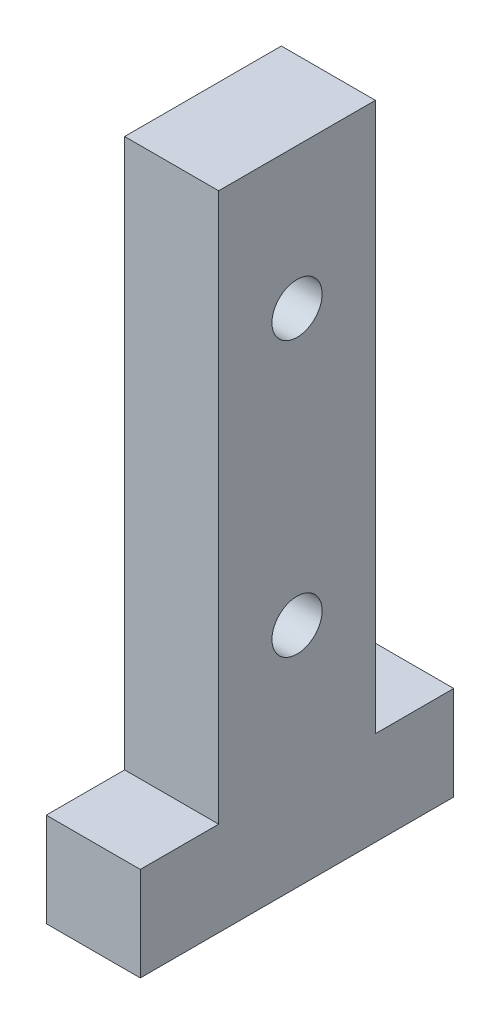
from build123d import *

# Parameters (mm, degrees)
SKETCH1_R           = 1.6
BOSS_EXTRUDE1_DEPTH = 6


with BuildPart() as part:
    # Sketch1 → Boss-Extrude1 (new body)
    with BuildSketch(Plane(origin=(0, 0, 0), x_dir=(0, 0, -1), z_dir=(1, 0, 0))):
        Polygon((5, 6), (10, 6), (10, 0), (-10, 0), (-10, 6), (-5, 6), (-5, 41), (5, 41), align=None)
        with Locations((0, 32)):
            Circle(SKETCH1_R, mode=Mode.SUBTRACT)
        with Locations((0, 14.5)):
            Circle(SKETCH1_R, mode=Mode.SUBTRACT)
    extrude(amount=BOSS_EXTRUDE1_DEPTH)


solid = part.part
